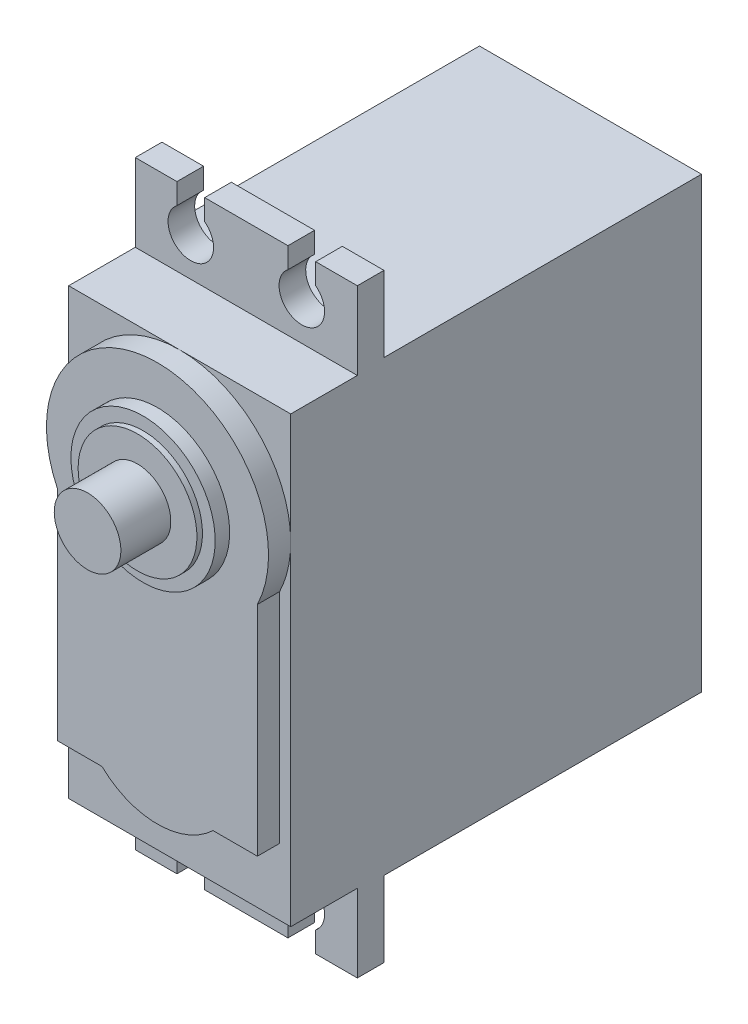
from build123d import *

# Parameters (mm, degrees)
ESQUISSE1_W             = 37
ESQUISSE1_H             = 54
BOSS_EXTRU_1_DEPTH      = 20
BOSS_EXTRU_2_DEPTH      = 2
ESQUISSE3_W             = 6
ESQUISSE3_H             = 7
ENL_V_MAT_EXTRU_1_DEPTH = 52.478150705
ESQUISSE4_W             = 6
ESQUISSE4_H             = 7
ENL_V_MAT_EXTRU_2_DEPTH = 52.478150705
BOSS_EXTRU_3_DEPTH      = 2
ESQUISSE6_W             = 28.6
ESQUISSE6_H             = 6.8
ENL_V_MAT_EXTRU_3_DEPTH = 52.478150705
ENL_V_MAT_EXTRU_4_DEPTH = 41.582754958
ENL_V_MAT_EXTRU_5_DEPTH = 41.582754958
ESQUISSE9_W             = 28.6
ESQUISSE9_H             = 6.8
ENL_V_MAT_EXTRU_6_DEPTH = 52.478150705
ENL_V_MAT_EXTRU_7_DEPTH = 43.308391603
ENL_V_MAT_EXTRU_8_DEPTH = 43.308391603
ESQUISSE12_W            = 2.05
ESQUISSE12_H            = 2.4
ESQUISSE13_W            = 2.05
ESQUISSE13_H            = 2.4
ESQUISSE14_W            = 2.05
ESQUISSE14_H            = 2.4
ESQUISSE15_W            = 2.05
ESQUISSE15_H            = 2.4


with BuildPart() as part:
    # Esquisse1 → Boss.-Extru.1 (new body)
    with BuildSketch(Plane(origin=(10, 0, 0), x_dir=(0, 0, -1), z_dir=(1, 0, 0))):
        with Locations((-18.5, 0)):
            Rectangle(ESQUISSE1_W, ESQUISSE1_H)
    extrude(amount=-BOSS_EXTRU_1_DEPTH)

    # Esquisse2 → Boss.-Extru.2 (add)
    with BuildSketch(Plane.XY.offset(37)):
        with BuildLine():
            Line((-9, -14), (-9, 5.641101056))
            ThreePointArc((-9, 5.641101056), (0, 20), (9, 5.641101056))
            Line((9, 5.641101056), (9, -14))
            Line((9, -14), (-9, -14))
        make_face()
    extrude(amount=BOSS_EXTRU_2_DEPTH)

    # Esquisse3 → Enlèv. mat.-Extru.1 (cut, through all)
    with BuildSketch(Plane(origin=(10, 0, 0), x_dir=(0, 0, -1), z_dir=(1, 0, 0))):
        with Locations((-34, 23.5)):
            Rectangle(ESQUISSE3_W, ESQUISSE3_H)
    extrude(amount=-ENL_V_MAT_EXTRU_1_DEPTH, mode=Mode.SUBTRACT)

    # Esquisse4 → Enlèv. mat.-Extru.2 (cut, through all)
    with BuildSketch(Plane.ZY.offset(10)):
        with Locations((34, -23.5)):
            Rectangle(ESQUISSE4_W, ESQUISSE4_H)
    extrude(amount=-ENL_V_MAT_EXTRU_2_DEPTH, mode=Mode.SUBTRACT)

    # Esquisse5 → Boss.-Extru.3 (add)
    with BuildSketch(Plane.XY.offset(37)):
        with BuildLine():
            Line((-5, -14), (5, -14))
            ThreePointArc((5, -14), (0, -16), (-5, -14))
        make_face()
    extrude(amount=BOSS_EXTRU_3_DEPTH)

    # Esquisse6 → Enlèv. mat.-Extru.3 (cut, through all)
    with BuildSketch(Plane.ZY.offset(10)):
        with Locations((14.3, -23.6)):
            Rectangle(ESQUISSE6_W, ESQUISSE6_H)
    extrude(amount=-ENL_V_MAT_EXTRU_3_DEPTH, mode=Mode.SUBTRACT)

    # Esquisse7 → Enlèv. mat.-Extru.4 (cut, through all)
    with BuildSketch(Plane(origin=(0, 0, 28.6), x_dir=(-1, 0, 0), z_dir=(0, 0, -1))):
        with BuildLine():
            Line((3.75, -27), (6.25, -27))
            Line((6.25, -27), (6.25, -25.124807681))
            ThreePointArc((6.25, -25.124807681), (5, -25.55), (3.75, -25.124807681))
            Line((3.75, -25.124807681), (3.75, -27))
        make_face()
    extrude(amount=-ENL_V_MAT_EXTRU_4_DEPTH, mode=Mode.SUBTRACT)

    # Esquisse8 → Enlèv. mat.-Extru.5 (cut, through all)
    with BuildSketch(Plane(origin=(0, 0, 28.6), x_dir=(-1, 0, 0), z_dir=(0, 0, -1))):
        with BuildLine():
            Line((-6.25, -27), (-3.75, -27))
            Line((-3.75, -27), (-3.75, -25.124807681))
            ThreePointArc((-3.75, -25.124807681), (-5, -25.55), (-6.25, -25.124807681))
            Line((-6.25, -25.124807681), (-6.25, -27))
        make_face()
    extrude(amount=-ENL_V_MAT_EXTRU_5_DEPTH, mode=Mode.SUBTRACT)

    # Esquisse9 → Enlèv. mat.-Extru.6 (cut, through all)
    with BuildSketch(Plane.ZY.offset(10)):
        with Locations((14.3, 23.6)):
            Rectangle(ESQUISSE9_W, ESQUISSE9_H)
    extrude(amount=-ENL_V_MAT_EXTRU_6_DEPTH, mode=Mode.SUBTRACT)

    # Esquisse10 → Enlèv. mat.-Extru.7 (cut, through all)
    with BuildSketch(Plane.XY.offset(31)):
        with BuildLine():
            Line((-3.75, 27), (-6.25, 27))
            Line((-6.25, 27), (-6.25, 25.124807681))
            ThreePointArc((-6.25, 25.124807681), (-5, 25.55), (-3.75, 25.124807681))
            Line((-3.75, 25.124807681), (-3.75, 27))
        make_face()
    extrude(amount=-ENL_V_MAT_EXTRU_7_DEPTH, mode=Mode.SUBTRACT)

    # Esquisse11 → Enlèv. mat.-Extru.8 (cut, through all)
    with BuildSketch(Plane.XY.offset(31)):
        with BuildLine():
            Line((6.25, 27), (3.75, 27))
            Line((3.75, 27), (3.75, 25.124807681))
            ThreePointArc((3.75, 25.124807681), (5, 25.55), (6.25, 25.124807681))
            Line((6.25, 25.124807681), (6.25, 27))
        make_face()
    extrude(amount=-ENL_V_MAT_EXTRU_8_DEPTH, mode=Mode.SUBTRACT)

    # Esquisse12 → Enlèvement de matière-Révolution1 (revolve, cut)
    with BuildSketch(Plane(origin=(0, 23.5, 0), x_dir=(1, 0, 0), z_dir=(0, 1, 0))):
        with Locations((6.025, -29.8)):
            Rectangle(ESQUISSE12_W, ESQUISSE12_H)
    revolve(axis=Axis((5, 23.5, 28.6), (0, 0, 1)), mode=Mode.SUBTRACT)

    # Esquisse13 → Enlèvement de matière-Révolution2 (revolve, cut)
    with BuildSketch(Plane.XZ.offset(-23.5)):
        with Locations((-3.975, 29.8)):
            Rectangle(ESQUISSE13_W, ESQUISSE13_H)
    revolve(axis=Axis((-5, 23.5, 31), (0, 0, -1)), mode=Mode.SUBTRACT)

    # Esquisse14 → Enlèvement de matière-Révolution3 (revolve, cut)
    with BuildSketch(Plane(origin=(0, -23.5, 0), x_dir=(1, 0, 0), z_dir=(0, 1, 0))):
        with Locations((-3.975, -29.8)):
            Rectangle(ESQUISSE14_W, ESQUISSE14_H)
    revolve(axis=Axis((-5, -23.5, 28.6), (0, 0, 1)), mode=Mode.SUBTRACT)

    # Esquisse15 → Enlèvement de matière-Révolution4 (revolve, cut)
    with BuildSketch(Plane.XZ.offset(23.5)):
        with Locations((6.025, 29.8)):
            Rectangle(ESQUISSE15_W, ESQUISSE15_H)
    revolve(axis=Axis((5, -23.5, 31), (0, 0, -1)), mode=Mode.SUBTRACT)

    # Esquisse16 → Révolution1 (revolve)
    with BuildSketch(Plane.XZ.offset(-10), mode=Mode.PRIVATE) as r_volution1_sk:
        Polygon((3, 45.3), (0, 45.3), (0, 39), (6.5, 39), (6.5, 40.3), (5.35, 40.3), (5.35, 40.8), (3, 40.8), align=None)
    revolve(r_volution1_sk.sketch.rotate(Axis((0, 10, 45.3), (0, 0, -1)), 180), axis=Axis((0, 10, 45.3), (0, 0, -1)))


solid = part.part
